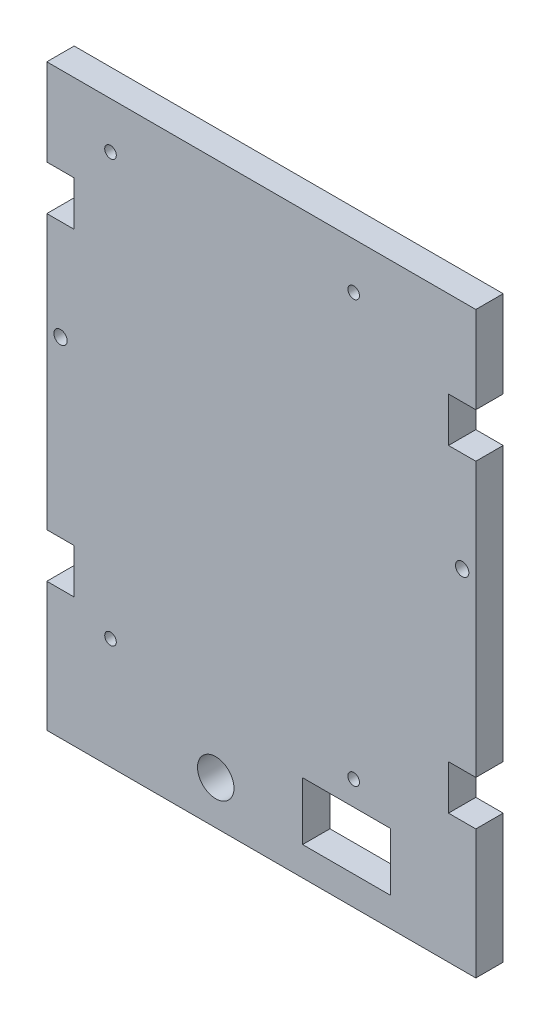
from build123d import *

# Parameters (mm, degrees)
SKETCH1_W           = 94.107
SKETCH1_H           = 127
BOSS_EXTRUDE1_DEPTH = 6
SKETCH2_W           = 5.9944
SKETCH2_H           = 9.779
CUT_EXTRUDE1_DEPTH  = 159.180679759
SKETCH3_R           = 1.27
CUT_EXTRUDE2_DEPTH  = 159.180679759
SKETCH4_R           = 4.0005
SKETCH4_W           = 19.304
SKETCH4_H           = 12.7
CUT_EXTRUDE3_DEPTH  = 159.180679759
SKETCH5_R           = 1.4605
CUT_EXTRUDE4_DEPTH  = 159.180679759


with BuildPart() as part:
    # Sketch1 → Boss-Extrude1 (new body)
    with BuildSketch(Plane.XY):
        with Locations((47.0535, 63.5)):
            Rectangle(SKETCH1_W, SKETCH1_H)
    extrude(amount=BOSS_EXTRUDE1_DEPTH)

    # Sketch2 → Cut-Extrude1 (cut, through all)
    with BuildSketch(Plane.XY.offset(6)):
        with Locations((2.9972, 103.0605)):
            Rectangle(SKETCH2_W, SKETCH2_H)
        with Locations((91.1098, 103.0605)):
            Rectangle(SKETCH2_W, SKETCH2_H)
        with Locations((2.9972, 33.2105)):
            Rectangle(SKETCH2_W, SKETCH2_H)
        with Locations((91.1098, 33.2105)):
            Rectangle(SKETCH2_W, SKETCH2_H)
    extrude(amount=-CUT_EXTRUDE1_DEPTH, mode=Mode.SUBTRACT)

    # Sketch3 → Cut-Extrude2 (cut, through all)
    with BuildSketch(Plane(origin=(0, 0, 0), x_dir=(-1, 0, 0), z_dir=(0, 0, -1))):
        with Locations((-67.31, 24.384)):
            Circle(SKETCH3_R)
        with Locations((-67.31, 116.84)):
            Circle(SKETCH3_R)
        with Locations((-13.97, 116.84)):
            Circle(SKETCH3_R)
        with Locations((-13.97, 24.384)):
            Circle(SKETCH3_R)
    extrude(amount=-CUT_EXTRUDE2_DEPTH, mode=Mode.SUBTRACT)

    # Sketch4 → Cut-Extrude3 (cut, through all)
    with BuildSketch(Plane.XY.offset(6)):
        with Locations((37.0586, 9.525)):
            Circle(SKETCH4_R)
        with Locations((65.7606, 12.7)):
            Rectangle(SKETCH4_W, SKETCH4_H)
    extrude(amount=-CUT_EXTRUDE3_DEPTH, mode=Mode.SUBTRACT)

    # Sketch5 → Cut-Extrude4 (cut, through all)
    with BuildSketch(Plane.XY.offset(6)):
        with Locations((2.9972, 76.2)):
            Circle(SKETCH5_R)
        with Locations((91.1098, 76.2)):
            Circle(SKETCH5_R)
    extrude(amount=-CUT_EXTRUDE4_DEPTH, mode=Mode.SUBTRACT)


solid = part.part
